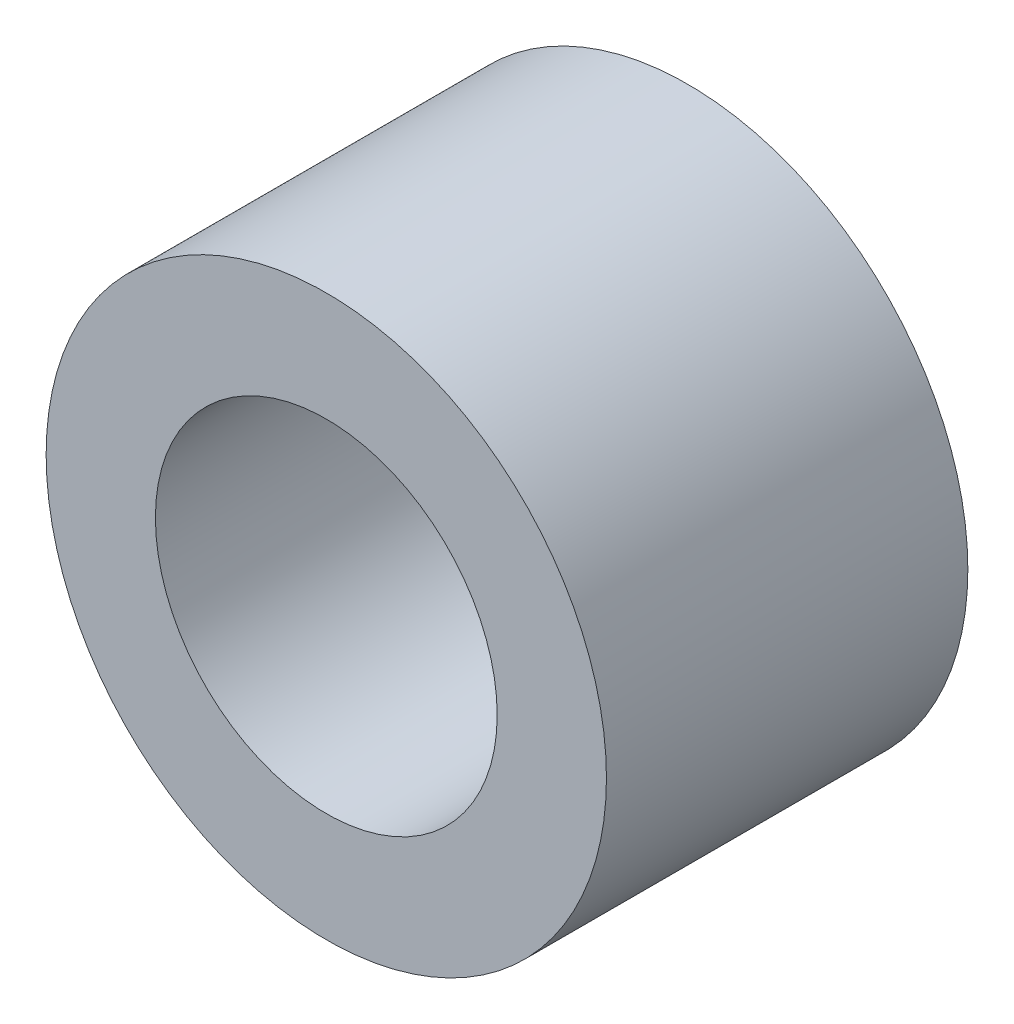
from build123d import *

# Parameters (mm, degrees)
SKETCH1_R           = 10
SKETCH1_R_2         = 6.1
BOSS_EXTRUDE1_DEPTH = 6.45


with BuildPart() as part:
    # Sketch1 → Boss-Extrude1 (new, symmetric)
    with BuildSketch(Plane.XY):
        with Locations(Location((0, 0, 0), (0, 0, 180))):
            Circle(SKETCH1_R)
        with Locations(Location((0, 0, 0), (0, 0, 180))):
            Circle(SKETCH1_R_2, mode=Mode.SUBTRACT)
    extrude(amount=BOSS_EXTRUDE1_DEPTH, both=True)


solid = part.part
